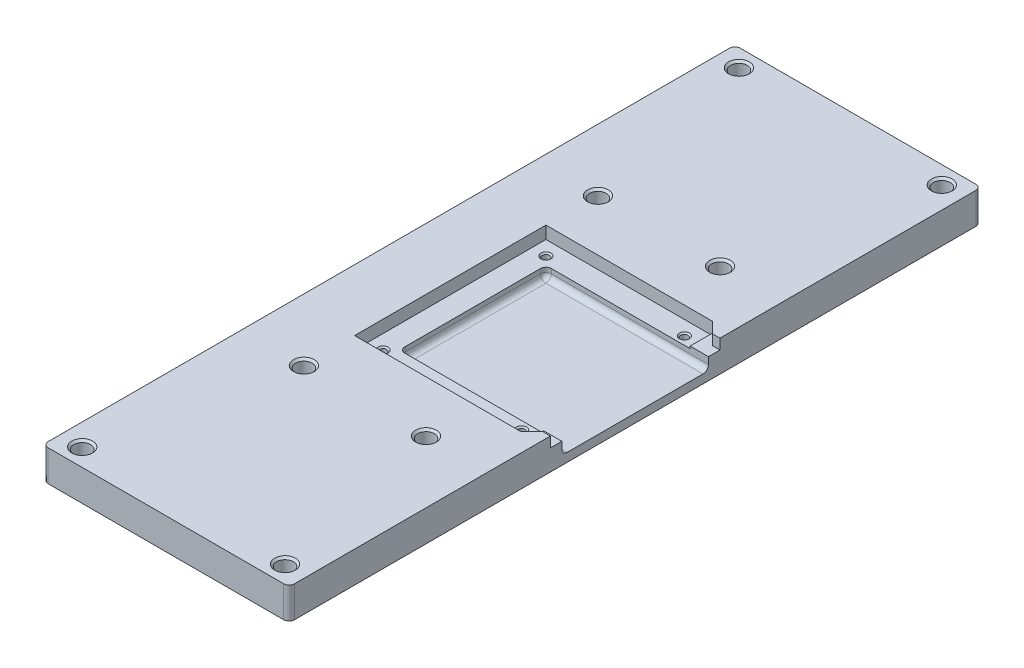
from build123d import *

# Parameters (mm, degrees)
BOSS_EXTRUDE1_DEPTH     = 11.5
SKETCH4_R               = 3.075
CUT_EXTRUDE1_DEPTH      = 6
CUT_EXTRUDE6_DEPTH      = 4.6
CUT_EXTRUDE3_DEPTH      = 136.509227084
CUT_EXTRUDE3_DEPTH_BACK = 3.7
SKETCH24_W              = 59.875
SKETCH24_H              = 54
SKETCH25_R              = 1.35
CUT_EXTRUDE4_DEPTH      = 5
CHAMFER4_SIZE           = 0.5
FILLET1_R               = 2
BOSS_EXTRUDE2_DEPTH     = 0.8
CHAMFER5_SIZE           = 0.75


with BuildPart() as part:
    # Sketch1 → Boss-Extrude1 (new body)
    with BuildSketch(Plane(origin=(0, 0, 0), x_dir=(1, 0, 0), z_dir=(0, 1, 0))):
        with BuildLine():
            Line((-45.375, 112.5), (-45.375, -112.5))
            Line((-45.375, -112.5), (-45.375, -125.5))
            ThreePointArc((-45.375, -125.5), (-44.789213562, -126.914213562), (-43.375, -127.5))
            Line((-43.375, -127.5), (43.375, -127.5))
            ThreePointArc((43.375, -127.5), (44.789213562, -126.914213562), (45.375, -125.5))
            Line((45.375, -125.5), (45.375, -112.5))
            Line((45.375, -112.5), (45.375, 112.5))
            Line((45.375, 112.5), (45.375, 125.5))
            ThreePointArc((45.375, 125.5), (44.789213562, 126.914213562), (43.375, 127.5))
            Line((43.375, 127.5), (-43.375, 127.5))
            ThreePointArc((-43.375, 127.5), (-44.789213562, 126.914213562), (-45.375, 125.5))
            Line((-45.375, 125.5), (-45.375, 112.5))
        make_face()
    extrude(amount=BOSS_EXTRUDE1_DEPTH)

    # Sketch4 → Cut-Extrude1 (cut)
    with BuildSketch(Plane(origin=(0, 11.5, 0), x_dir=(1, 0, 0), z_dir=(0, 1, 0))):
        with Locations(Location((-37.375, -121, 0), (0, 0, 270))):
            Circle(SKETCH4_R)
        with Locations(Location((37.375, -121, 0), (0, 0, 270))):
            Circle(SKETCH4_R)
        with Locations(Location((37.375, 121, 0), (0, 0, 270))):
            Circle(SKETCH4_R)
        with Locations(Location((-37.375, 121, 0), (0, 0, 270))):
            Circle(SKETCH4_R)
        with Locations(Location((-22.5, -54.175, 0), (0, 0, 270))):
            Circle(SKETCH4_R)
        with Locations(Location((22.5, -54.175, 0), (0, 0, 270))):
            Circle(SKETCH4_R)
        with Locations(Location((22.5, 54.175, 0), (0, 0, 270))):
            Circle(SKETCH4_R)
        with Locations(Location((-22.5, 54.175, 0), (0, 0, 270))):
            Circle(SKETCH4_R)
    extrude(amount=-CUT_EXTRUDE1_DEPTH, mode=Mode.SUBTRACT)

    # Sketch21 → Cut-Extrude6 (cut)
    with BuildSketch(Plane(origin=(0, 11.5, 0), x_dir=(1, 0, 0), z_dir=(0, 1, 0))):
        Polygon((45.375, 31), (45.375, -31), (45.375, -31.25), (42.603553391, -31.25), (38.603553391, -35.25), (-22.75, -35.25), (-22.75, 35.25), (38.603553391, 35.25), (42.603553391, 31.25), (45.375, 31.25), align=None)
    extrude(amount=-CUT_EXTRUDE6_DEPTH, mode=Mode.SUBTRACT)

    # Sketch24 → Cut-Extrude3 (cut, two sides: drawn at the far end of the back side and taken through both)
    with BuildSketch(Plane(origin=(0, 6.9, 0), x_dir=(1, 0, 0), z_dir=(0, 1, 0)).offset(-CUT_EXTRUDE3_DEPTH_BACK)):
        with Locations((15.4375, 0)):
            Rectangle(SKETCH24_W, SKETCH24_H)
    extrude(amount=CUT_EXTRUDE3_DEPTH + CUT_EXTRUDE3_DEPTH_BACK, mode=Mode.SUBTRACT)

    # Sketch25 → Cut-Extrude4 (cut)
    with BuildSketch(Plane(origin=(0, 6.9, 0), x_dir=(1, 0, 0), z_dir=(0, 1, 0))):
        with Locations(Location((33.5, 30, 0), (0, 0, 270))):
            Circle(SKETCH25_R)
        with Locations(Location((-17.5, 30, 0), (0, 0, 270))):
            Circle(SKETCH25_R)
        with Locations(Location((33.5, -30, 0), (0, 0, 270))):
            Circle(SKETCH25_R)
        with Locations(Location((-17.5, -30, 0), (0, 0, 270))):
            Circle(SKETCH25_R)
    extrude(amount=-CUT_EXTRUDE4_DEPTH, mode=Mode.SUBTRACT)

    # Chamfer4
    chamfer4_edges = [part.edges().sort_by_distance(p)[0] for p in [
        (-17.5, 6.9, -31.35),
        (33.5, 6.9, 28.65),
        (-17.5, 6.9, 28.65),
        (33.5, 6.9, -31.35),
    ]]
    chamfer(chamfer4_edges, length=CHAMFER4_SIZE)

    # Fillet1
    fillet1_edges = [part.edges().sort_by_distance(p)[0] for p in [
        (15.4375, 3.2, -27),
        (-14.5, 5.05, -27),
        (-14.5, 3.2, 0),
        (-14.5, 5.05, 27),
        (15.4375, 3.2, 27),
    ]]
    fillet(fillet1_edges, radius=FILLET1_R)

    # Sketch26 → Boss-Extrude2 (add)
    with BuildSketch(Plane(origin=(0, 6.9, 0), x_dir=(1, 0, 0), z_dir=(0, 1, 0))):
        Polygon((38.603553391, 35.25), (38.603553391, 27), (45.375, 27), (45.375, 31.25), (42.603553391, 31.25), align=None)
        Polygon((42.603553391, -31.25), (38.603553391, -35.25), (38.603553391, -27), (45.375, -27), (45.375, -31.25), align=None)
    extrude(amount=BOSS_EXTRUDE2_DEPTH)

    # Chamfer5
    chamfer5_edges = [part.edges().sort_by_distance(p)[0] for p in [
        (37.375, 11.5, 117.925),
        (37.375, 11.5, -124.075),
        (-22.5, 11.5, 51.1),
        (22.5, 11.5, 51.1),
        (-22.5, 11.5, -57.25),
        (22.5, 11.5, -57.25),
        (-37.375, 11.5, -124.075),
        (-37.375, 11.5, 117.925),
    ]]
    chamfer(chamfer5_edges, length=CHAMFER5_SIZE)


solid = part.part
